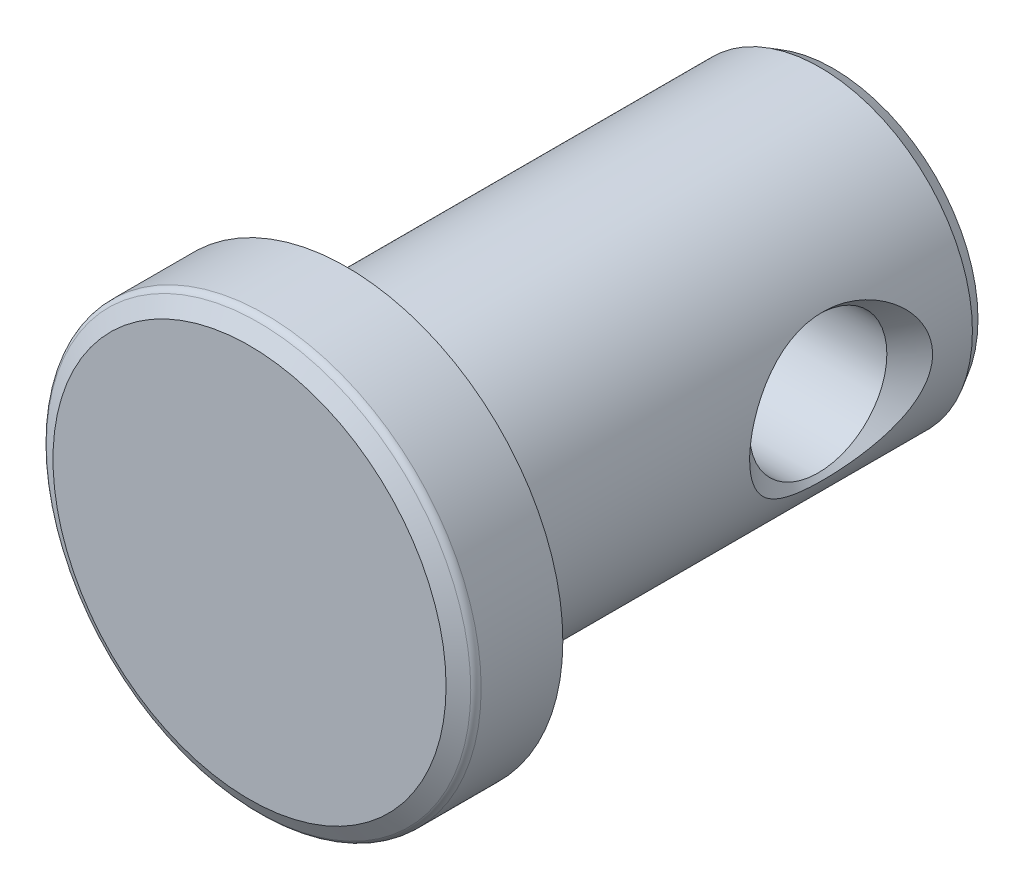
from build123d import *

# Parameters (mm, degrees)
CUT_EXTRUDE1_DEPTH      = 12.942538712
CUT_EXTRUDE1_DEPTH_BACK = 12.942538712
SKETCH3_R               = 1.7907
FILLET1_R               = 0.198755


with BuildPart() as part:
    # Sketch2 → Revolve1 (revolve)
    with BuildSketch(Plane(origin=(0, 0, 0), x_dir=(0, 0, -1), z_dir=(1, 0, 0)), mode=Mode.PRIVATE) as revolve1_sk:
        Polygon((6.35, 3.776345), (6.35, 0), (-8.89, 0), (-8.89, 5.1308), (-8.596706063, 5.6388), (-6.35, 5.6388), (-6.35, 3.9751), (6.005746242, 3.9751), align=None)
    revolve(revolve1_sk.sketch.rotate(Axis((0, 0, 6.35), (0, 0, -1)), 90), axis=Axis((0, 0, 6.35), (0, 0, -1)))

    # Sketch3 → Cut-Extrude1 (cut, two sides: drawn at the far end of the back side and taken through both)
    with BuildSketch(Plane(origin=(0, 0, 0), x_dir=(0, 0, -1), z_dir=(1, 0, 0)).offset(-CUT_EXTRUDE1_DEPTH_BACK)):
        with Locations((2.5781, 0)):
            Circle(SKETCH3_R)
    extrude(amount=CUT_EXTRUDE1_DEPTH + CUT_EXTRUDE1_DEPTH_BACK, mode=Mode.SUBTRACT)

    # Fillet1
    fillet1_edges = [part.edges().sort_by_distance(p)[0] for p in [
        (-5.6388, 0, 8.596706063),
        (-3.9751, 0, 6.35),
    ]]
    fillet(fillet1_edges, radius=FILLET1_R)

    # Sketch4 → Cut-Revolve1 (revolve, cut)
    with BuildSketch(Plane(origin=(0, 0, 0), x_dir=(1, 0, 0), z_dir=(0, 1, 0)), mode=Mode.PRIVATE) as cut_revolve1_sk:
        Polygon((3.9751, 2.5781), (3.9751, 0.1905), (1.5875, 2.5781), align=None)
        Polygon((-3.9751, 0.1905), (-1.5875, 2.5781), (-3.9751, 2.5781), align=None)
    revolve(cut_revolve1_sk.sketch.rotate(Axis((3.9751, 0, -2.5781), (-1, 0, 0)), 180), axis=Axis((3.9751, 0, -2.5781), (-1, 0, 0)), mode=Mode.SUBTRACT)


solid = part.part
